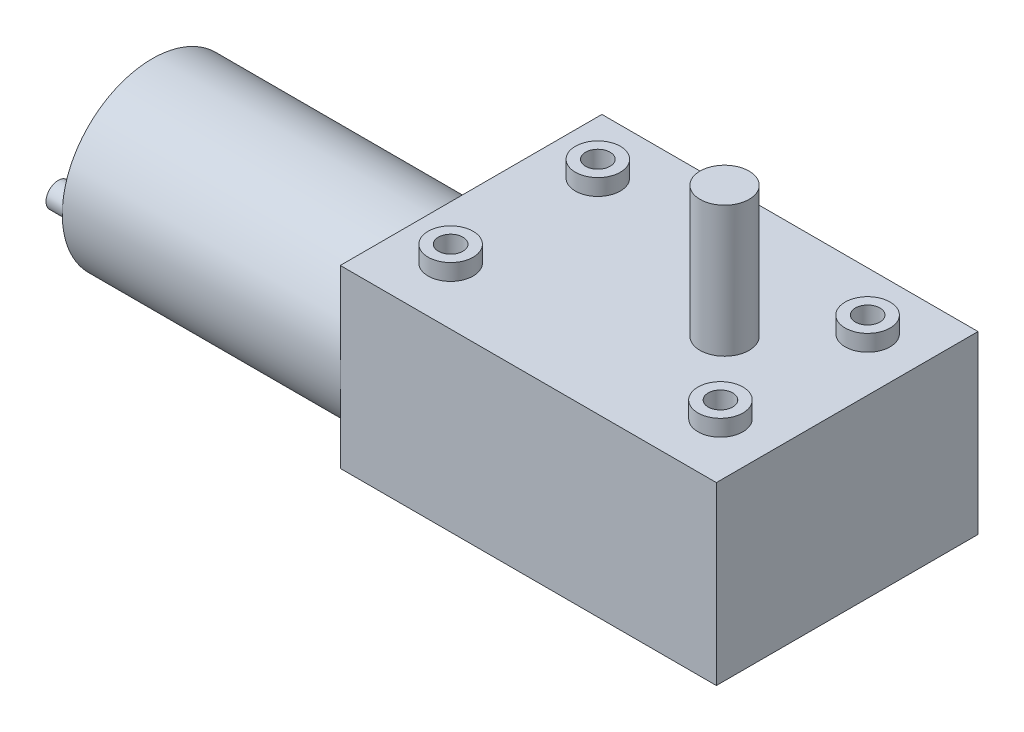
from build123d import *
from build123d.topology import SkipClean

# Parameters (mm, degrees)
SKETCH1_W                 = 46
SKETCH1_H                 = 32
BOSS_EXTRUDE1_DEPTH       = 21.5
F_3_0MM_DOWEL_HOLE1_D     = 3
F_3_0MM_DOWEL_HOLE1_DEPTH = 5.59
F_3_0MM_DOWEL_HOLE1_TIP   = 0.901290929
SKETCH2_R                 = 2.75
SKETCH2_R_2               = 1.5
BOSS_EXTRUDE2_DEPTH       = 2
SKETCH4_R                 = 3
BOSS_EXTRUDE3_DEPTH       = 16
SKETCH5_R                 = 11
BOSS_EXTRUDE4_DEPTH       = 34
SKETCH6_R                 = 1.5
BOSS_EXTRUDE5_DEPTH       = 2


with BuildPart() as part:
    # Sketch1 → Boss-Extrude1 (new body)
    with BuildSketch(Plane(origin=(0, 0, 0), x_dir=(1, 0, 0), z_dir=(0, 1, 0))):
        Rectangle(SKETCH1_W, SKETCH1_H)
    extrude(amount=BOSS_EXTRUDE1_DEPTH)

    # Ø3.0mm Dowel Hole1
    with Locations(Plane(origin=(-16.5, 21.5, -9), x_dir=(0, 0, 1), z_dir=(0, 1, 0))):
        with Locations((0, 0), (0, 33), (18, 33), (18, 0)):
            Hole(F_3_0MM_DOWEL_HOLE1_D / 2, depth=F_3_0MM_DOWEL_HOLE1_DEPTH)
            with Locations((0, 0, -(F_3_0MM_DOWEL_HOLE1_DEPTH + F_3_0MM_DOWEL_HOLE1_TIP / 2))):  # 118° drill point
                Cone(0, F_3_0MM_DOWEL_HOLE1_D / 2, F_3_0MM_DOWEL_HOLE1_TIP, mode=Mode.SUBTRACT)

    # Sketch2 → Boss-Extrude2 (add)
    # profile 1 of 4: a face of its own
    with SkipClean():  # the faces are left unmerged after this step: merging them gives an invalid solid
        with BuildSketch(Plane(origin=(0, 21.5, 0), x_dir=(1, 0, 0), z_dir=(0, 1, 0))):
            with Locations(Location((-16.5, 9, 0), (0, 0, 90))):
                Circle(SKETCH2_R)
            with Locations(Location((-16.5, 9, 0), (0, 0, 270))):
                Circle(SKETCH2_R_2, mode=Mode.SUBTRACT)
        # profile 2 of 4: a face of its own
        with BuildSketch(Plane(origin=(0, 21.5, 0), x_dir=(1, 0, 0), z_dir=(0, 1, 0))):
            with Locations(Location((-16.5, -9, 0), (0, 0, 90))):
                Circle(SKETCH2_R)
            with Locations(Location((-16.5, -9, 0), (0, 0, 270))):
                Circle(SKETCH2_R_2, mode=Mode.SUBTRACT)
        # profile 3 of 4: a face of its own
        with BuildSketch(Plane(origin=(0, 21.5, 0), x_dir=(1, 0, 0), z_dir=(0, 1, 0))):
            with Locations(Location((16.5, -9, 0), (0, 0, 90))):
                Circle(SKETCH2_R)
            with Locations(Location((16.5, -9, 0), (0, 0, 270))):
                Circle(SKETCH2_R_2, mode=Mode.SUBTRACT)
        # profile 4 of 4: a face of its own
        with BuildSketch(Plane(origin=(0, 21.5, 0), x_dir=(1, 0, 0), z_dir=(0, 1, 0))):
            with Locations(Location((16.5, 9, 0), (0, 0, 90))):
                Circle(SKETCH2_R)
            with Locations(Location((16.5, 9, 0), (0, 0, 270))):
                Circle(SKETCH2_R_2, mode=Mode.SUBTRACT)
        extrude(amount=BOSS_EXTRUDE2_DEPTH)

    # Sketch4 → Boss-Extrude3 (add)
    with SkipClean():  # the faces are left unmerged after this step: merging them gives an invalid solid
        with BuildSketch(Plane(origin=(0, 21.5, 0), x_dir=(1, 0, 0), z_dir=(0, 1, 0))):
            with Locations(Location((8, 0, 0), (0, 0, 90))):
                Circle(SKETCH4_R)
        extrude(amount=BOSS_EXTRUDE3_DEPTH)

    # Sketch5 → Boss-Extrude4 (add)
    with SkipClean():  # the faces are left unmerged after this step: merging them gives an invalid solid
        with BuildSketch(Plane.ZY.offset(23)):
            with Locations((5, 9.9)):
                Circle(SKETCH5_R)
        extrude(amount=BOSS_EXTRUDE4_DEPTH)

    # Sketch6 → Boss-Extrude5 (add)
    with SkipClean():  # the faces are left unmerged after this step: merging them gives an invalid solid
        with BuildSketch(Plane.ZY.offset(57)):
            with Locations(Location((14.493087222, 10.262346512, 0), (0, 0, 2.185178942))):
                Circle(SKETCH6_R)
            with Locations(Location((-4.494735344, 10.216228957, 0), (0, 0, 178.091716281))):
                Circle(SKETCH6_R)
        extrude(amount=BOSS_EXTRUDE5_DEPTH)


solid = part.part
